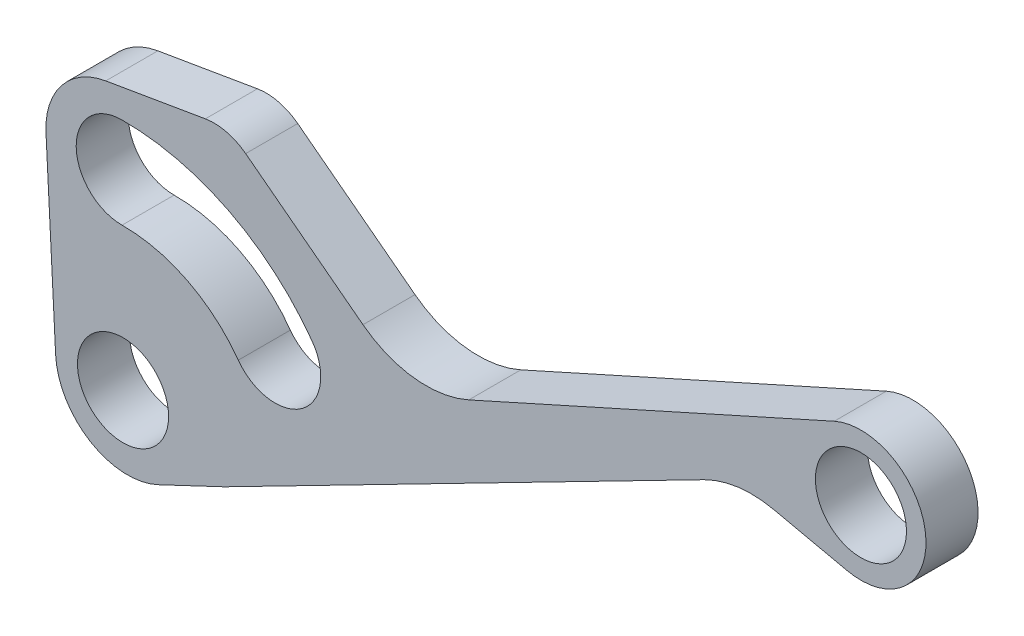
from build123d import *

# Parameters (mm, degrees)
SKETCH2_R           = 1.75
BOSS_EXTRUDE1_DEPTH = 2
SCALE1_SCALE        = 2


with BuildPart() as part:
    # Sketch2 → Boss-Extrude1 (new body)
    with BuildSketch(Plane.XY):
        with BuildLine():
            Line((-2.959686812, 7.094235734), (-2.589510897, -0.112410482))
            ThreePointArc((-2.589510897, -0.112410482), (-1.247895547, -2.342588234), (1.351636108, -2.469315214))
            Line((1.351636108, -2.469315214), (3.894134078, -1.267559521))
            Line((3.894134078, -1.267559521), (22.318004544, 8.181471599))
            ThreePointArc((22.318004544, 8.181471599), (23.631672458, 8.589402593), (25.00585725, 8.528187863))
            Line((25.00585725, 8.528187863), (27.810968992, 7.908802431))
            ThreePointArc((27.810968992, 7.908802431), (30.836871293, 10.605873355), (27.325176398, 12.630293092))
            Line((27.325176398, 12.630293092), (13.285071523, 6.320301234))
            ThreePointArc((13.285071523, 6.320301234), (11.187238244, 5.995090505), (9.218440829, 6.78913284))
            Line((9.218440829, 6.78913284), (4.711624461, 10.229038009))
            ThreePointArc((4.711624461, 10.229038009), (3.977045573, 10.581042261), (3.163031294, 10.61094026))
            Line((3.163031294, 10.61094026), (-0.662699736, 9.960674362))
            ThreePointArc((-0.662699736, 9.960674362), (-2.356294969, 8.964265917), (-2.959686812, 7.094235734))
        make_face()
        Circle(SKETCH2_R, mode=Mode.SUBTRACT)
        with Locations((28.35, 10.35)):
            Circle(SKETCH2_R, mode=Mode.SUBTRACT)
        with BuildLine():
            ThreePointArc((-0.062114538, 8.972511771), (-1.799958067, 7.210439165), (-0.037885462, 5.472595636))
            ThreePointArc((-0.037885462, 5.472595636), (2.468926518, 4.884172412), (4.429179601, 3.21451495))
            ThreePointArc((4.429179601, 3.21451495), (6.873384478, 2.826104706), (7.261794722, 5.270309583))
            ThreePointArc((7.261794722, 5.270309583), (4.047891296, 8.007771334), (-0.062114538, 8.972511771))
        make_face(mode=Mode.SUBTRACT)
    extrude(amount=BOSS_EXTRUDE1_DEPTH)


with BuildPart() as part_1:
    # Scale1: scaled about (9.442389577, 5.344617661, 1)
    add(part.part.scale(SCALE1_SCALE).moved(Location((-9.442389577, -5.344617661, -1))))


solid = part_1.part
